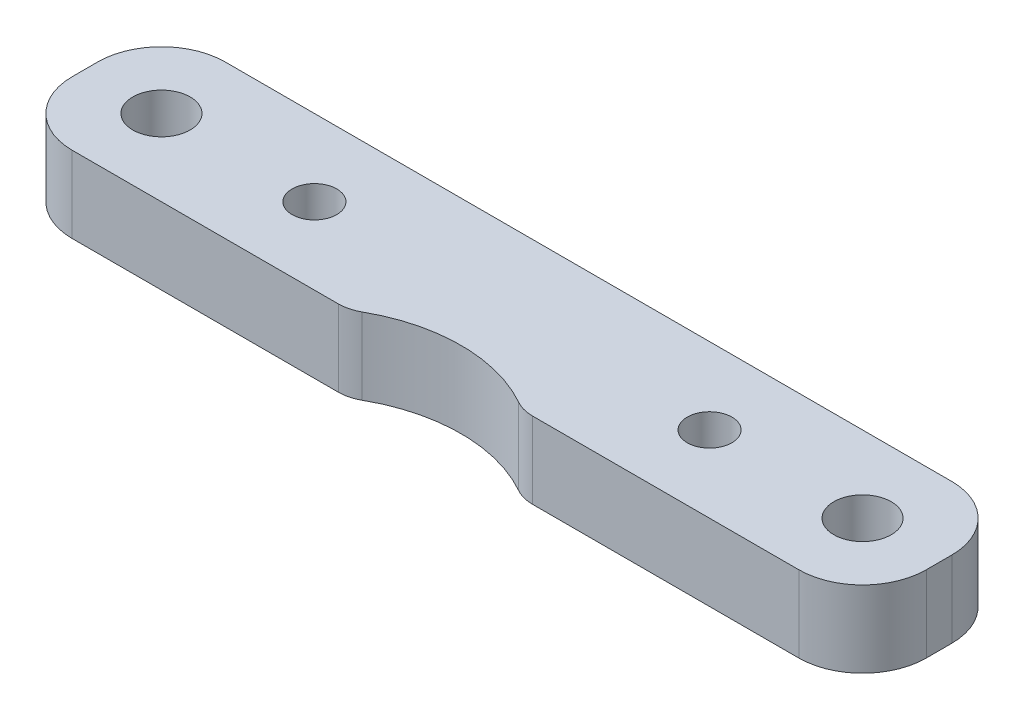
from build123d import *

# Parameters (mm, degrees)
SKETCH1_R           = 1.75
SKETCH1_R_2         = 2.25
BOSS_EXTRUDE1_DEPTH = 6


with BuildPart() as part:
    # Sketch1 → Boss-Extrude1 (new body)
    with BuildSketch(Plane(origin=(0, 0, 0), x_dir=(1, 0, 0), z_dir=(0, 1, 0))):
        with BuildLine():
            Line((-28.5, 6), (28.5, 6))
            ThreePointArc((28.5, 6), (32.035533906, 4.535533906), (33.5, 1))
            Line((33.5, 1), (33.5, -1))
            ThreePointArc((33.5, -1), (32.035533906, -4.535533906), (28.5, -6))
            Line((28.5, -6), (7.615773106, -6))
            ThreePointArc((7.615773106, -6), (6.853772344, -5.901612455), (6.141752505, -5.612903226))
            ThreePointArc((6.141752505, -5.612903226), (0, -4), (-6.141752505, -5.612903226))
            ThreePointArc((-6.141752505, -5.612903226), (-6.853772344, -5.901612455), (-7.615773106, -6))
            Line((-7.615773106, -6), (-28.5, -6))
            ThreePointArc((-28.5, -6), (-32.035533906, -4.535533906), (-33.5, -1))
            Line((-33.5, -1), (-33.5, 1))
            ThreePointArc((-33.5, 1), (-32.035533906, 4.535533906), (-28.5, 6))
        make_face()
        with Locations(Location((-15.5, 0, 0), (0, 0, 270))):
            Circle(SKETCH1_R, mode=Mode.SUBTRACT)
        with Locations(Location((15.5, 0, 0), (0, 0, 270))):
            Circle(SKETCH1_R, mode=Mode.SUBTRACT)
        with Locations(Location((27.5, 0, 0), (0, 0, 270))):
            Circle(SKETCH1_R_2, mode=Mode.SUBTRACT)
        with Locations(Location((-27.5, 0, 0), (0, 0, 270))):
            Circle(SKETCH1_R_2, mode=Mode.SUBTRACT)
    extrude(amount=BOSS_EXTRUDE1_DEPTH)


solid = part.part
